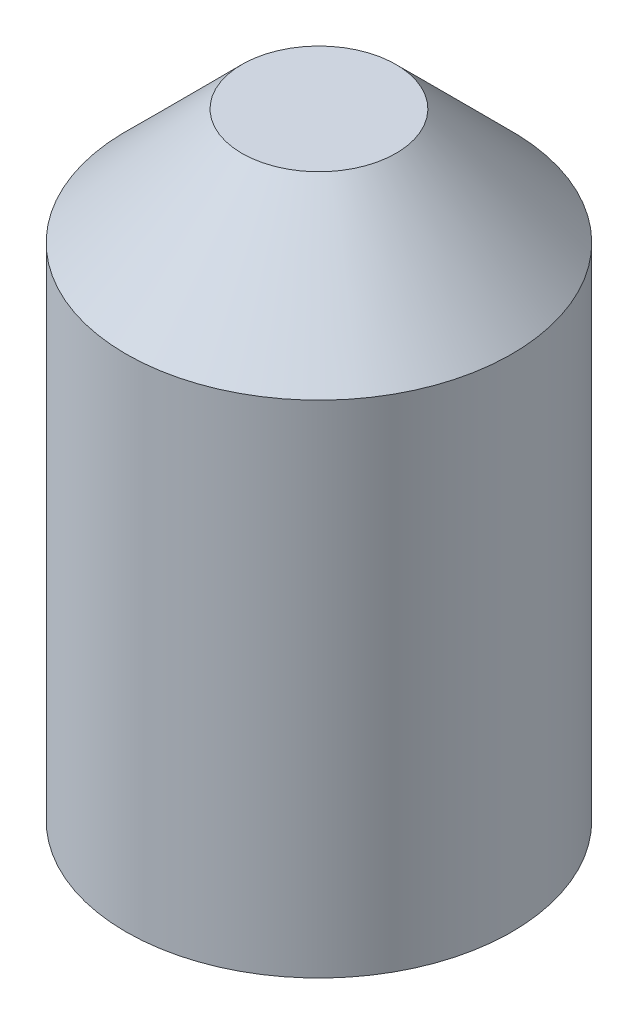
from build123d import *


with BuildPart() as part:
    # Sketch1 → Revolve1 (revolve)
    with BuildSketch(Plane.XY, mode=Mode.PRIVATE) as revolve1_sk:
        Polygon((1.7272, 1.0668), (1.7272, 9.525), (0, 10.522199385), (0, 12.7), (1.5875, 12.7), (3.9751, 10.3124), (3.9751, 0), (2.794, 0), align=None)
    revolve(revolve1_sk.sketch.rotate(Axis((0, -6.746701152, 0), (0, -1, 0)), 90), axis=Axis((0, -6.746701152, 0), (0, -1, 0)))


solid = part.part
